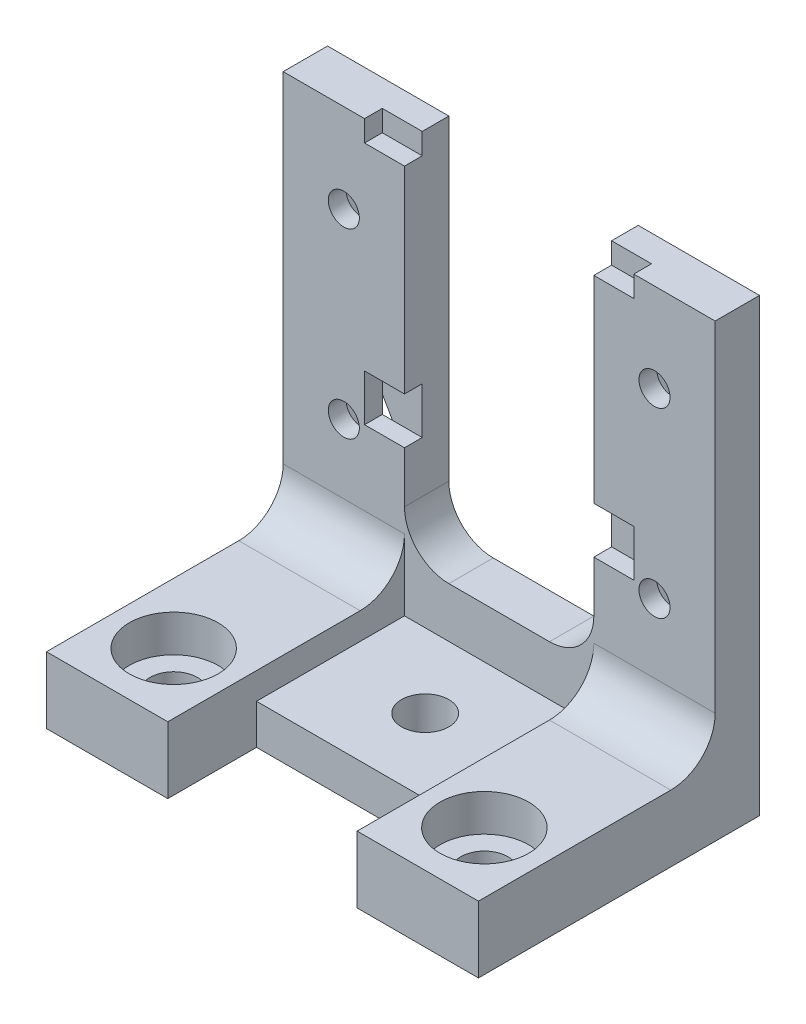
from build123d import *

# Parameters (mm, degrees)
ESBO_O2_W                  = 8.2
ESBO_O2_H                  = 30.460387467
RESSALTO_EXTRUS_O1_DEPTH   = 3
RESSALTO_EXTRUS_O1_2_DEPTH = 3
RESSALTO_EXTRUS_O2_REACH   = 32.935
ESBO_O3_W                  = 3
ESBO_O3_H                  = 6.088150409
ESBO_O4_W                  = 12.8
ESBO_O4_H                  = 2.7
RESSALTO_EXTRUS_O3_DEPTH   = 10
ESBO_O5_W                  = 8.2
ESBO_O5_H                  = 4.5
RESSALTO_EXTRUS_O4_DEPTH   = 16
CORTE_EXTRUS_O1_DEPTH      = 34.348189118
CORTE_EXTRUS_O1_DEPTH_BACK = 34.348189118
ESBO_O6_R                  = 1.6
ESBO_O7_R                  = 3
CORTE_EXTRUS_O2_DEPTH      = 2.5
ESBO_O8_R                  = 1.05
CORTE_EXTRUS_O3_DEPTH      = 32.131124741
FILETE1_R                  = 3
ESBO_O9_W                  = 1.2
ESBO_O9_H                  = 3.148787123
CORTE_EXTRUS_O4_DEPTH      = 2.7
FILETE2_R                  = 3
CORTE_EXTRUS_O5_DEPTH      = 1.8
ESBO_O13_W                 = 2.7
ESBO_O13_H                 = 3.148787123
CORTE_EXTRUS_O7_DEPTH      = 1.2


with BuildPart() as part:
    # Esboço2 → Ressalto-extrusão1 (new body)
    with BuildSketch(Plane(origin=(0, 0, -1), x_dir=(-1, 0, 0), z_dir=(0, 0, -1))):
        with Locations((10.5, -7.130193734)):
            Rectangle(ESBO_O2_W, ESBO_O2_H)
    extrude(amount=RESSALTO_EXTRUS_O1_DEPTH)


with BuildPart() as body_2:
    # Esboço2 → Ressalto-extrus_o1 2 (new body)
    with BuildSketch(Plane(origin=(0, 0, -1), x_dir=(-1, 0, 0), z_dir=(0, 0, -1))):
        with Locations((-10.5, -7.130193734)):
            Rectangle(ESBO_O2_W, ESBO_O2_H)
    extrude(amount=RESSALTO_EXTRUS_O1_2_DEPTH)

    # Esboço3 → Ressalto-extrusão2 (add, up to next)
    with BuildSketch(Plane(origin=(-6.4, 0, 0), x_dir=(0, 0, -1), z_dir=(1, 0, 0)), mode=Mode.PRIVATE) as ressalto_extrus_o2_sk1:
        with Locations((2.5, -19.316312263)):
            Rectangle(ESBO_O3_W, ESBO_O3_H)
    ressalto_extrus_o2_tool1 = extrude(ressalto_extrus_o2_sk1.sketch, amount=RESSALTO_EXTRUS_O2_REACH, mode=Mode.PRIVATE) - body_2.part

    add(part.part)  # Ressalto-extrusão2 merges part
    add(ressalto_extrus_o2_tool1.solids().sort_by_distance((-6.4, -19.316312, -2.5))[0])

    # Esboço4 → Ressalto-extrusão3 (add)
    with BuildSketch(Plane.XY.offset(-1)):
        with Locations((0, -21.010387467)):
            Rectangle(ESBO_O4_W, ESBO_O4_H)
    extrude(amount=RESSALTO_EXTRUS_O3_DEPTH)

    # Esboço5 → Ressalto-extrusão4 (add)
    with BuildSketch(Plane.XY.offset(-1)):
        with Locations((-10.5, -20.110387467)):
            Rectangle(ESBO_O5_W, ESBO_O5_H)
        with Locations((10.5, -20.110387467)):
            Rectangle(ESBO_O5_W, ESBO_O5_H)
    extrude(amount=RESSALTO_EXTRUS_O4_DEPTH)

    # Esboço6 → Corte-extrusão1 (cut, two sides: drawn at the far end of the back side and taken through both)
    with BuildSketch(Plane(origin=(0, -17.860387467, 0), x_dir=(1, 0, 0), z_dir=(0, 1, 0)).offset(-CORTE_EXTRUS_O1_DEPTH_BACK)):
        with Locations(Location((0, -4, 0), (0, 0, 270))):
            Circle(ESBO_O6_R)
        with Locations(Location((10.5, -10.5, 0), (0, 0, 270))):
            Circle(ESBO_O6_R)
        with Locations(Location((-10.5, -10.5, 0), (0, 0, 270))):
            Circle(ESBO_O6_R)
    extrude(amount=CORTE_EXTRUS_O1_DEPTH + CORTE_EXTRUS_O1_DEPTH_BACK, mode=Mode.SUBTRACT)

    # Esboço7 → Corte-extrusão2 (cut)
    with BuildSketch(Plane(origin=(0, -17.860387467, 0), x_dir=(1, 0, 0), z_dir=(0, 1, 0))):
        with Locations(Location((10.5, -10.5, 0), (0, 0, 270))):
            Circle(ESBO_O7_R)
        with Locations(Location((-10.5, -10.5, 0), (0, 0, 270))):
            Circle(ESBO_O7_R)
    extrude(amount=-CORTE_EXTRUS_O2_DEPTH, mode=Mode.SUBTRACT)

    # Esboço8 → Corte-extrusão3 (cut, through all)
    with BuildSketch(Plane.XY.offset(-1)):
        with Locations((-10.5, 2.1)):
            Circle(ESBO_O8_R)
        with Locations((10.5, 2.1)):
            Circle(ESBO_O8_R)
        with Locations((10.5, -10.2)):
            Circle(ESBO_O8_R)
        with Locations((-10.5, -10.2)):
            Circle(ESBO_O8_R)
    extrude(amount=-CORTE_EXTRUS_O3_DEPTH, mode=Mode.SUBTRACT)

    # Filete1
    filete1_edges = [body_2.edges().sort_by_distance(p)[0] for p in [
        (6.4, -16.272237058, -2.5),
        (-6.4, -16.272237058, -2.5),
    ]]
    fillet(filete1_edges, radius=FILETE1_R)

    # Esboço9 → Corte-extrusão4 (cut)
    with BuildSketch(Plane.ZY.offset(-6.4)):
        with Locations((-1.6, -8.245598841)):
            Rectangle(ESBO_O9_W, ESBO_O9_H)
    extrude(amount=-CORTE_EXTRUS_O4_DEPTH, mode=Mode.SUBTRACT)

    # Filete2
    filete2_edges = [body_2.edges().sort_by_distance(p)[0] for p in [
        (-10.5, -17.860387467, -1),
        (10.5, -17.860387467, -1),
    ]]
    fillet(filete2_edges, radius=FILETE2_R)

    # Esboço10 → Corte-extrusão5 (cut)
    with BuildSketch(Plane(origin=(0, 0, -4), x_dir=(-1, 0, 0), z_dir=(0, 0, -1))):
        Polygon((12.809401077, 2.1), (11.654700538, 4.1), (9.345299462, 4.1), (8.190598923, 2.1), (9.345299462, 0.1), (11.654700538, 0.1), align=None)
        Polygon((12.809401077, -10.2), (11.654700538, -8.2), (9.345299462, -8.2), (8.190598923, -10.2), (9.345299462, -12.2), (11.654700538, -12.2), align=None)
        Polygon((-11.654700538, -12.2), (-12.809401077, -10.2), (-11.654700538, -8.2), (-9.345299462, -8.2), (-8.190598923, -10.2), (-9.345299462, -12.2), align=None)
        Polygon((-11.654700538, 0.1), (-12.809401077, 2.1), (-11.654700538, 4.1), (-9.345299462, 4.1), (-8.190598923, 2.1), (-9.345299462, 0.1), align=None)
    extrude(amount=-CORTE_EXTRUS_O5_DEPTH, mode=Mode.SUBTRACT)

    # Esboço13 → Corte-extrusão7 (cut)
    with BuildSketch(Plane.XY.offset(-1)):
        with Locations((7.75, -8.245598841)):
            Rectangle(ESBO_O13_W, ESBO_O13_H)
        with Locations((7.75, 8.245598841)):
            Rectangle(ESBO_O13_W, ESBO_O13_H)
        with Locations((-7.75, 8.245598841)):
            Rectangle(ESBO_O13_W, ESBO_O13_H)
        with Locations((-7.75, -8.245598841)):
            Rectangle(ESBO_O13_W, ESBO_O13_H)
    extrude(amount=-CORTE_EXTRUS_O7_DEPTH, mode=Mode.SUBTRACT)


solid = body_2.part
